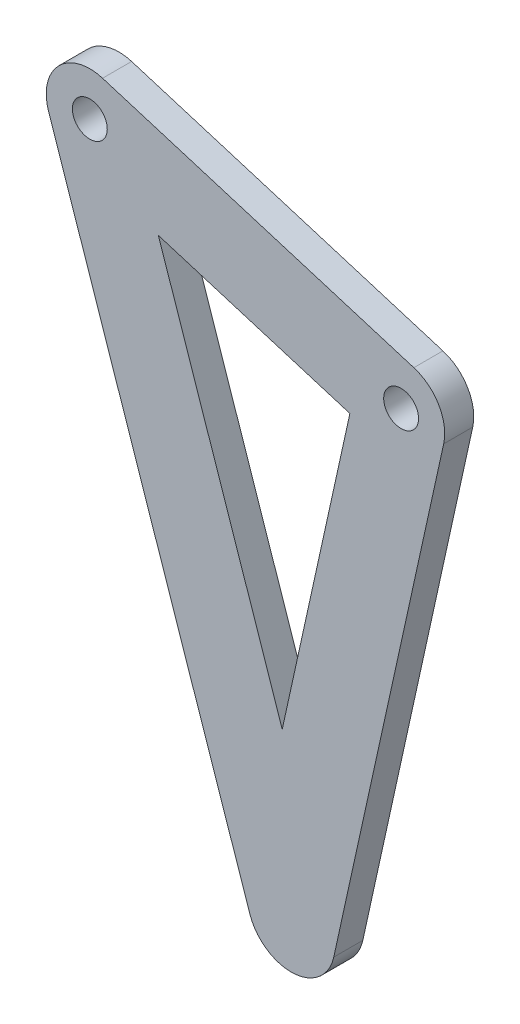
from build123d import *

# Parameters (mm, degrees)
BOSS_EXTRU_1_DEPTH           = 5
ENL_V_MAT_EXTRU_1_DEPTH      = 189.858435052
ENL_V_MAT_EXTRU_1_DEPTH_BACK = 189.858435052
ESQUISSE2_R                  = 3


with BuildPart() as part:
    # Esquisse1 → Boss.-Extru.1 (new body)
    with BuildSketch(Plane.XY):
        with BuildLine():
            Line((-111.688798728, -44.532571199), (-77.044116728, -146.825024533))
            ThreePointArc((-77.044116728, -146.825024533), (-69.528491269, -151.907819965), (-62.615784867, -146.03126267))
            Line((-62.615784867, -146.03126267), (-43.700257251, -60.088241923))
            ThreePointArc((-43.700257251, -60.088241923), (-44.549891694, -54.691461284), (-48.835290369, -51.302880733))
            Line((-48.835290369, -51.302880733), (-102.395499985, -34.953448145))
            ThreePointArc((-102.395499985, -34.953448145), (-109.968158579, -36.904307457), (-111.688798728, -44.532571199))
        make_face()
        Polygon((-59.838234907, -63.627479624), (-71.476166828, -116.504620821), (-92.791588673, -53.5683585), align=None, mode=Mode.SUBTRACT)
    extrude(amount=-BOSS_EXTRU_1_DEPTH)

    # Esquisse2 → Enlèv. mat.-Extru.1 (cut, two sides: drawn at the far end of the back side and taken through both)
    with BuildSketch(Plane.XY.offset(-ENL_V_MAT_EXTRU_1_DEPTH_BACK)):
        with Locations((-51.024946519, -58.476123092)):
            Circle(ESQUISSE2_R)
        with Locations((-104.585156135, -42.126690504)):
            Circle(ESQUISSE2_R)
    extrude(amount=ENL_V_MAT_EXTRU_1_DEPTH + ENL_V_MAT_EXTRU_1_DEPTH_BACK, mode=Mode.SUBTRACT)


solid = part.part
